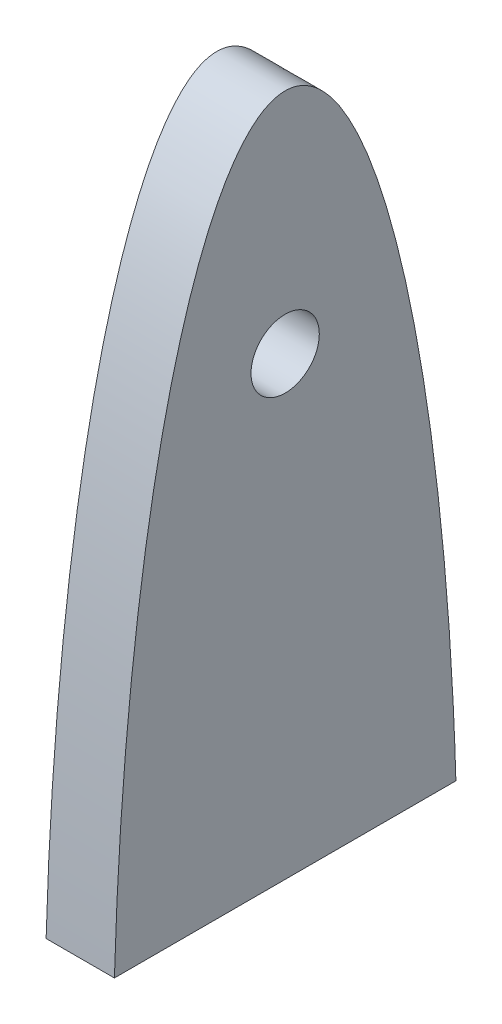
from build123d import *

# Parameters (mm, degrees)
SKETCH2_R           = 1.5
BOSS_EXTRUDE1_DEPTH = 3


with BuildPart() as part:
    # Sketch2 → Boss-Extrude1 (new body)
    with BuildSketch(Plane(origin=(0, 0, 0), x_dir=(0, 0, -1), z_dir=(1, 0, 0))):
        with BuildLine():
            add(Edge.make_bspline(
                [(-7.5, 0), (0, 250), (7.5, 0)],
                knots=[0, 0, 0, 1, 1, 1], degree=2, weights=[1, 0.136363636, 1]))
            Line((7.5, 0), (-7.5, 0))
        make_face()
        with Locations((0, 20)):
            Circle(SKETCH2_R, mode=Mode.SUBTRACT)
    extrude(amount=BOSS_EXTRUDE1_DEPTH)


solid = part.part
